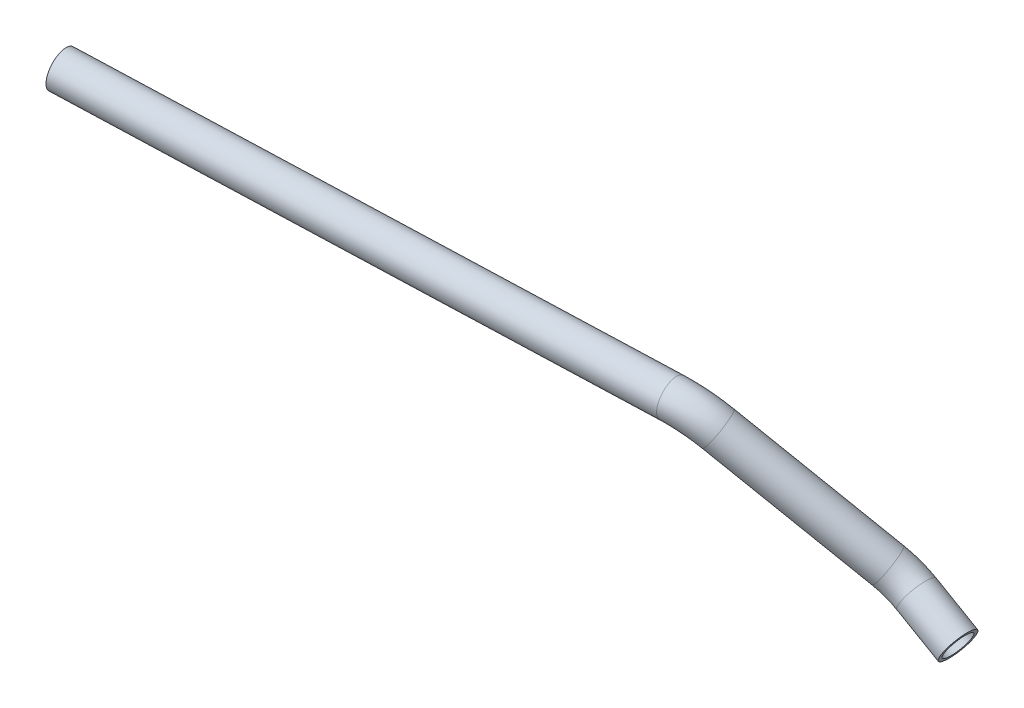
from build123d import *

# Parameters (mm, degrees)
ESQUISSE1_R                       = 10
ESQUISSE1_R_2                     = 8
EXTRUSION1_REACH                  = 433.016
EXTRUSION1_END_RADIUS             = 8
ESQUISSE3_R                       = 2
EXTRUSION1_DIRECTION_2_REACH      = 433.016
EXTRUSION1_DIRECTION_2_END_RADIUS = 8


with BuildPart() as part:
    # Balayage1: sweep along a curve in space
    with BuildLine() as balayage1_path:
        Line((0, 0, 0), (12.990381057, -7.5, 0))
        Line((0, 0, 0), (-10.26979763, 5.929270426, 0))
        ThreePointArc((-23.243938294, 14.727794485, 2.973935241), (-17.035828208, 10.165933144, 0.751028422), (-10.26979763, 5.929270426, 0))
        Line((-23.243938294, 14.727794485, 2.973935241), (-86.480363257, 65.200039483, 34.722605481))
        ThreePointArc((-106.469208033, 73.428950509, 40.880198038), (-95.752548684, 70.629649492, 38.3883833), (-86.480363257, 65.200039483, 34.722605481))
        Line((-106.469208033, 73.428950509, 40.880198038), (-400, 110, 89))
    # Esquisse1 → Balayage1 (sweep)
    with BuildSketch(Plane(origin=(-400, 110, 89), x_dir=(0.15933409799773637, -0.019851461389881916, 0.9870251084425026), z_dir=(-0.9794525040369775, 0.12203014804395138, 0.1605659842683569))):
        Circle(ESQUISSE1_R)
        Circle(ESQUISSE1_R_2, mode=Mode.SUBTRACT)
    sweep(path=balayage1_path.line)

    # Extrusion1: up to this cylinder (the profile starts inside it)
    extrusion1_end = Plane(origin=(6.062177957, -3.500000075, 0), z_dir=(0.866025403784438, -0.500000000000001, 0)) * Cylinder(EXTRUSION1_END_RADIUS, 883.032, mode=Mode.PRIVATE)
    # Esquisse3 → Extrusion1 (add, up to the surface)
    with BuildSketch(Plane.XY, mode=Mode.PRIVATE) as extrusion1_sk1:
        with Locations((6.062177826, -3.5)):
            Circle(ESQUISSE3_R)
    extrusion1_tool1 = extrude(extrusion1_sk1.sketch, amount=EXTRUSION1_REACH, mode=Mode.PRIVATE) & extrusion1_end
    add(extrusion1_tool1.solids().sort_by_distance((6.062178, -3.5, 0))[0])

    # Extrusion1 direction 2: up to this cylinder (the profile starts inside it)
    extrusion1_direction_2_end = Plane(origin=(6.062177957, -3.500000075, 0), z_dir=(0.866025403784438, -0.500000000000001, 0)) * Cylinder(EXTRUSION1_DIRECTION_2_END_RADIUS, 883.032, mode=Mode.PRIVATE)
    # Esquisse3 → Extrusion1 direction 2 (add, up to the surface)
    with BuildSketch(Plane.XY, mode=Mode.PRIVATE) as extrusion1_direction_2_sk1:
        with Locations((6.062177826, -3.5)):
            Circle(ESQUISSE3_R)
    extrusion1_direction_2_tool1 = extrude(extrusion1_direction_2_sk1.sketch, amount=-EXTRUSION1_DIRECTION_2_REACH, mode=Mode.PRIVATE) & extrusion1_direction_2_end
    add(extrusion1_direction_2_tool1.solids().sort_by_distance((6.062178, -3.5, 0))[0])


solid = part.part
